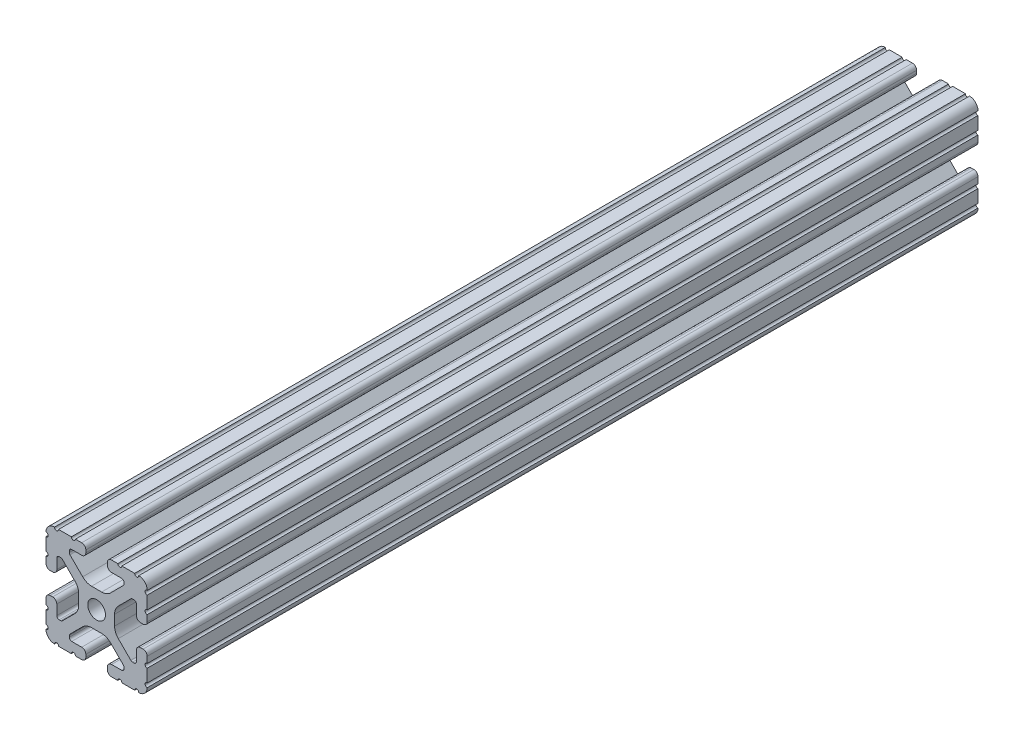
from build123d import *

# Parameters (mm, degrees)
SKETCH1_R      = 3.3274
EXTRUDE1_DEPTH = 312.7


with BuildPart() as part:
    # Sketch1 → Extrude1 (new body)
    with BuildSketch(Plane.XY):
        with BuildLine():
            Line((-10.022898969, 12.91475973), (-5.252158105, 8.144007132))
            ThreePointArc((-5.252158105, 8.144007132), (-3.715177372, 7.117027388), (-1.902183975, 6.7564))
            Line((-1.902183975, 6.7564), (1.902183975, 6.7564))
            ThreePointArc((1.902183975, 6.7564), (3.715177372, 7.117027388), (5.252158105, 8.144007132))
            Line((5.252158105, 8.144007132), (10.022898969, 12.91475973))
            ThreePointArc((10.022898969, 12.91475973), (10.218362387, 13.207291992), (10.287, 13.552357131))
            Line((10.287, 13.552357131), (10.287, 14.0843))
            ThreePointArc((10.287, 14.0843), (10.022898185, 14.721898185), (9.3853, 14.986))
            Line((9.3853, 14.986), (5.617617549, 14.986))
            ThreePointArc((5.617617549, 14.986), (4.519044045, 15.441044045), (4.064, 16.539617549))
            Line((4.064, 16.539617549), (4.064, 17.496382451))
            ThreePointArc((4.064, 17.496382451), (4.519044045, 18.594955955), (5.617617549, 19.05))
            Line((5.617617549, 19.05), (7.974178704, 19.05))
            ThreePointArc((7.974178704, 19.05), (8.736178704, 18.288), (9.498178704, 19.05))
            Line((9.498178704, 19.05), (14.327719207, 19.05))
            ThreePointArc((14.327719207, 19.05), (15.087603123, 18.231251131), (15.847487039, 19.05))
            ThreePointArc((15.847487039, 19.05), (18.120176289, 18.120192083), (19.05, 15.847509295))
            ThreePointArc((19.05, 15.847509295), (18.231250992, 15.08762539), (19.05, 14.327741484))
            Line((19.05, 14.327741484), (19.05, 9.496091471))
            ThreePointArc((19.05, 9.496091471), (18.231250992, 8.736207565), (19.05, 7.97632366))
            Line((19.05, 7.97632366), (19.05, 5.617617549))
            ThreePointArc((19.05, 5.617617549), (18.594955955, 4.519044045), (17.496382451, 4.064))
            Line((17.496382451, 4.064), (16.539617549, 4.064))
            ThreePointArc((16.539617549, 4.064), (15.441044045, 4.519044045), (14.986, 5.617617549))
            Line((14.986, 5.617617549), (14.986, 9.385342516))
            ThreePointArc((14.986, 9.385342516), (14.721898185, 10.022940701), (14.0843, 10.287042516))
            Line((14.0843, 10.287042516), (13.516042086, 10.287042516))
            ThreePointArc((13.516042086, 10.287042516), (13.170975923, 10.218404478), (12.878443117, 10.022939917))
            Line((12.878443117, 10.022939917), (8.14758008, 5.292065243))
            ThreePointArc((8.14758008, 5.292065243), (7.117955879, 3.751120653), (6.7564, 1.933453584))
            Line((6.7564, 1.933453584), (6.7564, -1.933453584))
            ThreePointArc((6.7564, -1.933453584), (7.117955879, -3.751120653), (8.14758008, -5.292065243))
            Line((8.14758008, -5.292065243), (12.878443117, -10.022939917))
            ThreePointArc((12.878443117, -10.022939917), (13.170975923, -10.218404478), (13.516042086, -10.287042516))
            Line((13.516042086, -10.287042516), (14.0843, -10.287042516))
            ThreePointArc((14.0843, -10.287042516), (14.721898185, -10.022940701), (14.986, -9.385342516))
            Line((14.986, -9.385342516), (14.986, -5.617617549))
            ThreePointArc((14.986, -5.617617549), (15.441044045, -4.519044045), (16.539617549, -4.064))
            Line((16.539617549, -4.064), (17.496382451, -4.064))
            ThreePointArc((17.496382451, -4.064), (18.594955955, -4.519044045), (19.05, -5.617617549))
            Line((19.05, -5.617617549), (19.05, -7.976318491))
            ThreePointArc((19.05, -7.976318491), (18.231250992, -8.736202396), (19.05, -9.496086302))
            Line((19.05, -9.496086302), (19.05, -14.32774291))
            ThreePointArc((19.05, -14.32774291), (18.231250992, -15.087626816), (19.05, -15.847510721))
            ThreePointArc((19.05, -15.847510721), (18.120175716, -18.120192644), (15.847486868, -19.05))
            ThreePointArc((15.847486868, -19.05), (15.087602952, -18.231251131), (14.327719036, -19.05))
            Line((14.327719036, -19.05), (9.496062448, -19.05))
            ThreePointArc((9.496062448, -19.05), (8.736178532, -18.231251131), (7.976294616, -19.05))
            Line((7.976294616, -19.05), (5.617617549, -19.05))
            ThreePointArc((5.617617549, -19.05), (4.519044045, -18.594955955), (4.064, -17.496382451))
            Line((4.064, -17.496382451), (4.064, -16.539617549))
            ThreePointArc((4.064, -16.539617549), (4.519044045, -15.441044045), (5.617617549, -14.986))
            Line((5.617617549, -14.986), (9.3853, -14.986))
            ThreePointArc((9.3853, -14.986), (10.022898185, -14.721898185), (10.287, -14.0843))
            Line((10.287, -14.0843), (10.287, -13.552357131))
            ThreePointArc((10.287, -13.552357131), (10.218362387, -13.207291992), (10.022898969, -12.91475973))
            Line((10.022898969, -12.91475973), (5.252158105, -8.144007132))
            ThreePointArc((5.252158105, -8.144007132), (3.715177372, -7.117027388), (1.902183975, -6.7564))
            Line((1.902183975, -6.7564), (-1.902183975, -6.7564))
            ThreePointArc((-1.902183975, -6.7564), (-3.715177372, -7.117027388), (-5.252158105, -8.144007132))
            Line((-5.252158105, -8.144007132), (-10.022898969, -12.91475973))
            ThreePointArc((-10.022898969, -12.91475973), (-10.218362387, -13.207291992), (-10.287, -13.552357131))
            Line((-10.287, -13.552357131), (-10.287, -14.0843))
            ThreePointArc((-10.287, -14.0843), (-10.022898185, -14.721898185), (-9.3853, -14.986))
            Line((-9.3853, -14.986), (-5.617617549, -14.986))
            ThreePointArc((-5.617617549, -14.986), (-4.519044045, -15.441044045), (-4.064, -16.539617549))
            Line((-4.064, -16.539617549), (-4.064, -17.496382451))
            ThreePointArc((-4.064, -17.496382451), (-4.519044045, -18.594955955), (-5.617617549, -19.05))
            Line((-5.617617549, -19.05), (-7.976294616, -19.05))
            ThreePointArc((-7.976294616, -19.05), (-8.736178532, -18.231251131), (-9.496062448, -19.05))
            Line((-9.496062448, -19.05), (-14.327719036, -19.05))
            ThreePointArc((-14.327719036, -19.05), (-15.087602952, -18.231251131), (-15.847486868, -19.05))
            ThreePointArc((-15.847486868, -19.05), (-18.120175716, -18.120192644), (-19.05, -15.847510721))
            ThreePointArc((-19.05, -15.847510721), (-18.231250992, -15.087626816), (-19.05, -14.32774291))
            Line((-19.05, -14.32774291), (-19.05, -9.496086302))
            ThreePointArc((-19.05, -9.496086302), (-18.231250992, -8.736202396), (-19.05, -7.976318491))
            Line((-19.05, -7.976318491), (-19.05, -5.617617549))
            ThreePointArc((-19.05, -5.617617549), (-18.594955955, -4.519044045), (-17.496382451, -4.064))
            Line((-17.496382451, -4.064), (-16.539617549, -4.064))
            ThreePointArc((-16.539617549, -4.064), (-15.441044045, -4.519044045), (-14.986, -5.617617549))
            Line((-14.986, -5.617617549), (-14.986, -9.385342516))
            ThreePointArc((-14.986, -9.385342516), (-14.721898185, -10.022940701), (-14.0843, -10.287042516))
            Line((-14.0843, -10.287042516), (-13.516042086, -10.287042516))
            ThreePointArc((-13.516042086, -10.287042516), (-13.170975923, -10.218404478), (-12.878443117, -10.022939917))
            Line((-12.878443117, -10.022939917), (-8.14758008, -5.292065243))
            ThreePointArc((-8.14758008, -5.292065243), (-7.117955879, -3.751120653), (-6.7564, -1.933453584))
            Line((-6.7564, -1.933453584), (-6.7564, 1.933453584))
            ThreePointArc((-6.7564, 1.933453584), (-7.117955879, 3.751120653), (-8.14758008, 5.292065243))
            Line((-8.14758008, 5.292065243), (-12.878443117, 10.022939917))
            ThreePointArc((-12.878443117, 10.022939917), (-13.170975923, 10.218404478), (-13.516042086, 10.287042516))
            Line((-13.516042086, 10.287042516), (-14.0843, 10.287042516))
            ThreePointArc((-14.0843, 10.287042516), (-14.721898185, 10.022940701), (-14.986, 9.385342516))
            Line((-14.986, 9.385342516), (-14.986, 5.617617549))
            ThreePointArc((-14.986, 5.617617549), (-15.441044045, 4.519044045), (-16.539617549, 4.064))
            Line((-16.539617549, 4.064), (-17.496382451, 4.064))
            ThreePointArc((-17.496382451, 4.064), (-18.594955955, 4.519044045), (-19.05, 5.617617549))
            Line((-19.05, 5.617617549), (-19.05, 7.97632366))
            ThreePointArc((-19.05, 7.97632366), (-18.231250992, 8.736207565), (-19.05, 9.496091471))
            Line((-19.05, 9.496091471), (-19.05, 14.327741484))
            ThreePointArc((-19.05, 14.327741484), (-18.231250992, 15.08762539), (-19.05, 15.847509295))
            ThreePointArc((-19.05, 15.847509295), (-18.120176289, 18.120192083), (-15.847487039, 19.05))
            ThreePointArc((-15.847487039, 19.05), (-15.087603123, 18.231251131), (-14.327719207, 19.05))
            Line((-14.327719207, 19.05), (-9.498178704, 19.05))
            ThreePointArc((-9.498178704, 19.05), (-8.736178704, 18.288), (-7.974178704, 19.05))
            Line((-7.974178704, 19.05), (-5.617617549, 19.05))
            ThreePointArc((-5.617617549, 19.05), (-4.519044045, 18.594955955), (-4.064, 17.496382451))
            Line((-4.064, 17.496382451), (-4.064, 16.539617549))
            ThreePointArc((-4.064, 16.539617549), (-4.519044045, 15.441044045), (-5.617617549, 14.986))
            Line((-5.617617549, 14.986), (-9.3853, 14.986))
            ThreePointArc((-9.3853, 14.986), (-10.022898185, 14.721898185), (-10.287, 14.0843))
            Line((-10.287, 14.0843), (-10.287, 13.552357131))
            ThreePointArc((-10.287, 13.552357131), (-10.218362387, 13.207291992), (-10.022898969, 12.91475973))
        make_face()
        Circle(SKETCH1_R, mode=Mode.SUBTRACT)
    extrude(amount=-EXTRUDE1_DEPTH)


solid = part.part
